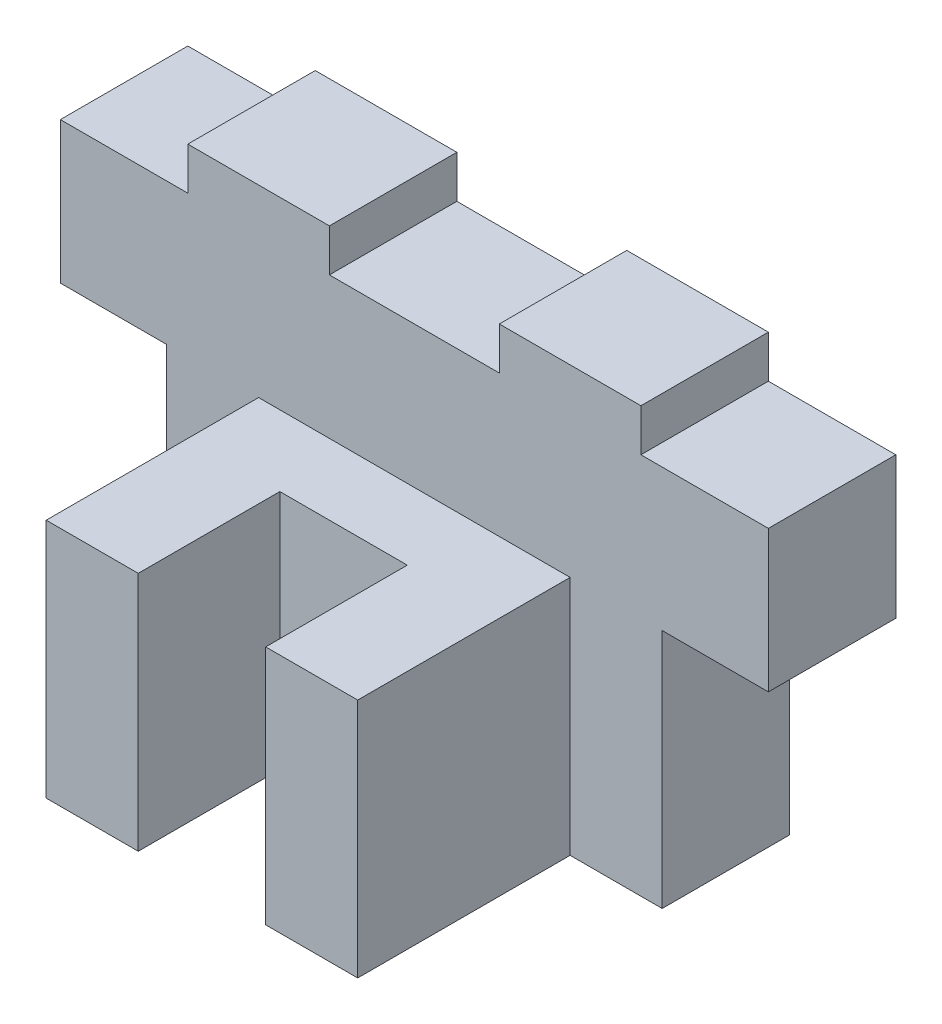
from build123d import *

# Parameters (mm, degrees)
EXTRUDE_1_DEPTH     = 9
SKETCH_2_W          = 4.5
SKETCH_2_H          = 6.5
EXTRUDE_2_DEPTH     = 17
SKETCH_3_W          = 9
SKETCH_3_H          = 1.5
CUT_EXTRUDE_1_DEPTH = 48.657633177


with BuildPart() as part:
    # Эскиз1 → Бобышка-Вытянуть1 (new body)
    with BuildSketch(Plane.XY):
        Polygon((-12.5, 12), (-12.5, -15), (5, -15), (5, 2), (12.5, 2), (12.5, 12), (3.5, 12), (3.5, 15), (-6.5, 15), (-6.5, 12), align=None)
    extrude_1 = extrude(amount=EXTRUDE_1_DEPTH)

    # Эскиз2 → Бобышка-Вытянуть2 (add)
    with BuildSketch(Plane.XZ.offset(15)):
        Polygon((-8, 15.5), (-8, 9), (-1.5, 9), (-1.5, 24), (-8, 24), align=None)
        with Locations((-10.25, 12.25)):
            Rectangle(SKETCH_2_W, SKETCH_2_H)
    extrude_2 = extrude(amount=-EXTRUDE_2_DEPTH)

    # Зеркальное отражение1: Бобышка-Вытянуть1, Бобышка-Вытянуть2 across plane
    add(extrude_1.mirror(Plane(origin=(-12.5, 0, 9), x_dir=(0, 0, 1), z_dir=(-1, 0, 0))))
    add(extrude_2.mirror(Plane(origin=(-12.5, 0, 9), x_dir=(0, 0, 1), z_dir=(-1, 0, 0))))

    # Эскиз3 → Вырез-Вытянуть1 (cut, through all)
    with BuildSketch(Plane(origin=(0, 2, 0), x_dir=(1, 0, 0), z_dir=(0, 1, 0))):
        with Locations((-12.5, -14.75)):
            Rectangle(SKETCH_3_W, SKETCH_3_H)
    extrude(amount=-CUT_EXTRUDE_1_DEPTH, mode=Mode.SUBTRACT)


solid = part.part
